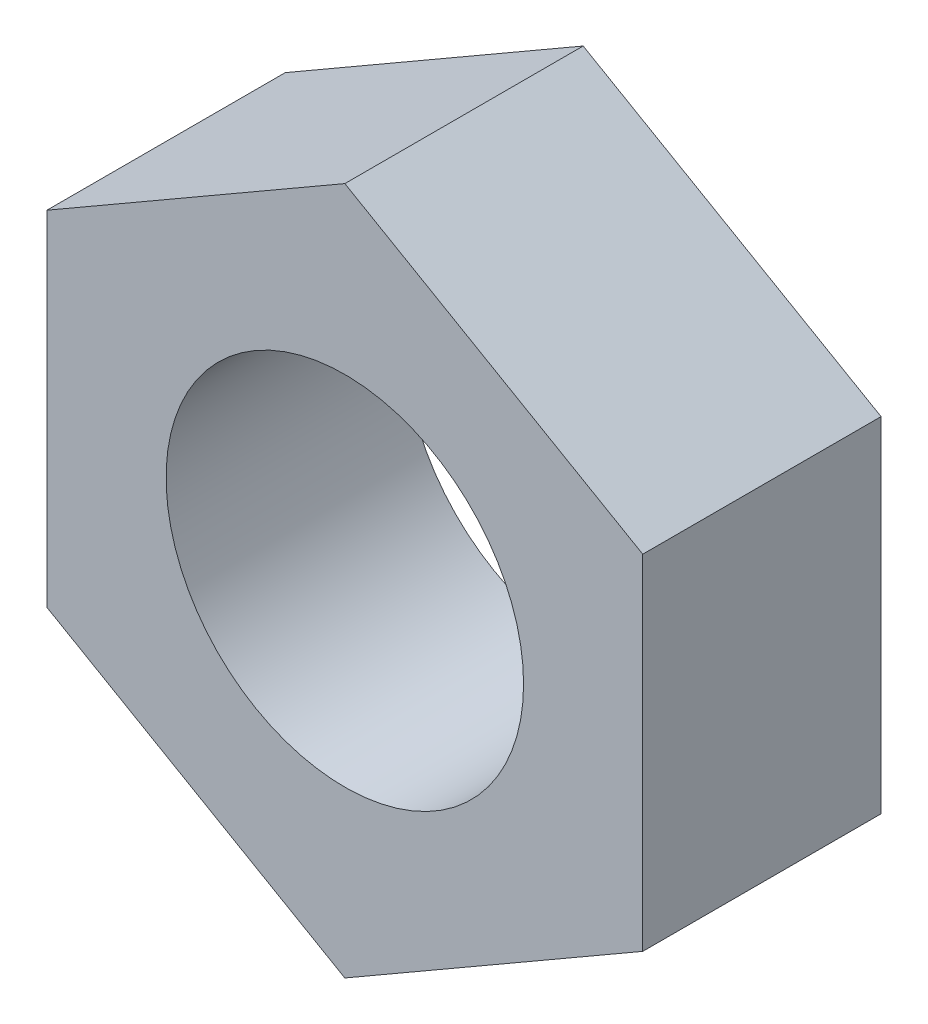
from build123d import *

# Parameters (mm, degrees)
SKETCH_1_R      = 1.5
EXTRUDE_1_DEPTH = 2


with BuildPart() as part:
    # 草图1 → 凸台-拉伸1 (new body)
    with BuildSketch(Plane.XY):
        Polygon((0, 2.886751346), (-2.5, 1.443375673), (-2.5, -1.443375673), (0, -2.886751346), (2.5, -1.443375673), (2.5, 1.443375673), align=None)
        Circle(SKETCH_1_R, mode=Mode.SUBTRACT)
    extrude(amount=EXTRUDE_1_DEPTH)


solid = part.part
